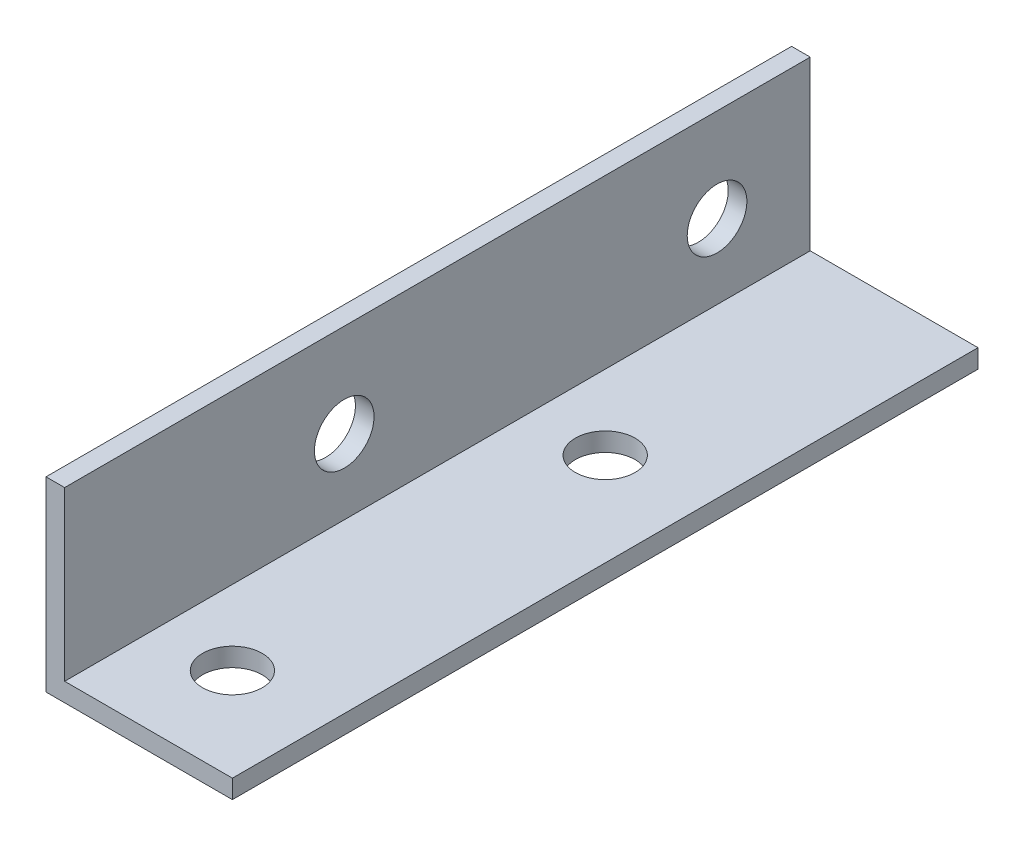
from build123d import *

# Parameters (mm, degrees)
EXTRUDE_1_DEPTH          = 40
CUT_EXTRUDE_1_DEPTH      = 42.533119315
CUT_EXTRUDE_1_DEPTH_BACK = 42.533119315
SKETCH_2_R               = 1.6
SKETCH_3_R               = 1.6
CUT_EXTRUDE_2_DEPTH      = 42.533119315


with BuildPart() as part:
    # ｽｹｯﾁ1 → ﾎﾞｽ - 押し出し1 (new body)
    with BuildSketch(Plane.XY):
        Polygon((-4, 5), (-4, -4), (5, -4), (5, -5), (-5, -5), (-5, 5), align=None)
    extrude(amount=EXTRUDE_1_DEPTH)

    # ｽｹｯﾁ2 → ｶｯﾄ - 押し出し1 (cut, two sides: drawn at the far end of the back side and taken through both)
    with BuildSketch(Plane.XZ.offset(5).offset(-CUT_EXTRUDE_1_DEPTH_BACK)):
        with Locations(Location((0, 15, 0), (0, 0, 270))):
            Circle(SKETCH_2_R)
        with Locations(Location((0, 35, 0), (0, 0, 270))):
            Circle(SKETCH_2_R)
    extrude(amount=CUT_EXTRUDE_1_DEPTH + CUT_EXTRUDE_1_DEPTH_BACK, mode=Mode.SUBTRACT)

    # ｽｹｯﾁ3 → ｶｯﾄ - 押し出し2 (cut, through all)
    with BuildSketch(Plane.ZY.offset(5)):
        with Locations((5, 0)):
            Circle(SKETCH_3_R)
        with Locations((25, 0)):
            Circle(SKETCH_3_R)
    extrude(amount=-CUT_EXTRUDE_2_DEPTH, mode=Mode.SUBTRACT)


solid = part.part
